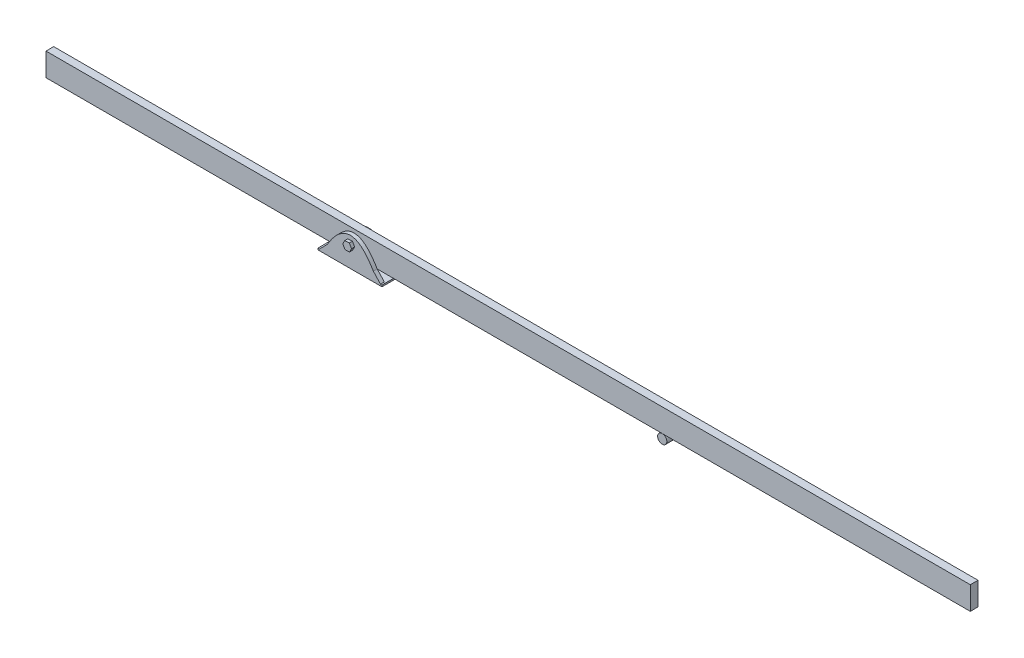
from build123d import *

# Parameters (mm, degrees)
SKETCH1_R                = 25
BOSS_EXTRUDE1_DEPTH      = 50
SKETCH1_R_2              = 30
BOSS_EXTRUDE1_2_DEPTH    = 50
SKETCH2_R                = 25
BOSS_EXTRUDE2_DEPTH      = 25
BOSS_EXTRUDE3_DEPTH      = 75
BOSS_EXTRUDE3_DEPTH_BACK = 25
SKETCH3_W                = 415.890953437
SKETCH3_H                = 10
SKETCH6_R                = 25
BOSS_EXTRUDE4_DEPTH      = 25
BOSS_EXTRUDE5_DEPTH      = 20
BOSS_EXTRUDE6_START      = 120
SKETCH10_R               = 25
BOSS_EXTRUDE6_DEPTH      = 120
SKETCH11_R               = 25
BOSS_EXTRUDE8_DEPTH      = 20


with BuildPart() as part:
    # Sketch1 → Boss-Extrude1 (new body)
    with BuildSketch(Plane.XY):
        Polygon((-3000, 75), (-3000, -75), (-1000, -75), (1000, -75), (3000, -75), (3000, 75), align=None)
        with Locations((-1000.00019516, -0.007806401)):
            Circle(SKETCH1_R, mode=Mode.SUBTRACT)
    extrude(amount=BOSS_EXTRUDE1_DEPTH)

    # Sketch2 → Boss-Extrude2 (add)
    with BuildSketch(Plane.XY.offset(50)):
        with BuildLine():
            Line((-1150.00019516, -75), (-1210.00019516, -135))
            Line((-1210.00019516, -135), (-794.109241723, -135))
            Line((-794.109241723, -135), (-850.00019516, -75))
            add(Edge.make_bspline(
                [(-1150.00019516, -75), (-1000.00019516, 179.221874073), (-850.00019516, -75)],
                knots=[0, 0, 0, 1, 1, 1], degree=2))
        make_face()
        with Locations((-1000.00019516, -0.007806401)):
            Circle(SKETCH2_R, mode=Mode.SUBTRACT)
    extrude(amount=BOSS_EXTRUDE2_DEPTH)

    # Sketch3 → Boss-Extrude3 (add, two sides: drawn at the far end of the back side and taken through both)
    with BuildSketch(Plane(origin=(0, 0, 50), x_dir=(-1, 0, 0), z_dir=(0, 0, -1)).offset(-BOSS_EXTRUDE3_DEPTH_BACK)):
        with Locations((1002.054718441, -130)):
            Rectangle(SKETCH3_W, SKETCH3_H)
    extrude(amount=BOSS_EXTRUDE3_DEPTH + BOSS_EXTRUDE3_DEPTH_BACK)

    # Sketch6 → Boss-Extrude4 (add)
    with BuildSketch(Plane(origin=(0, 0, -25), x_dir=(-1, 0, 0), z_dir=(0, 0, -1))):
        with BuildLine():
            Line((803.42440063, -125), (1200.00019516, -125))
            Line((1200.00019516, -125), (1150.00019516, -75))
            add(Edge.make_bspline(
                [(850.00019516, -75), (1000.00019516, 177.73404233), (1150.00019516, -75)],
                knots=[0, 0, 0, 1, 1, 1], degree=2))
            Line((850.00019516, -75), (803.42440063, -125))
        make_face()
        with Locations((1000.00019516, -0.007806401)):
            Circle(SKETCH6_R, mode=Mode.SUBTRACT)
    extrude(amount=-BOSS_EXTRUDE4_DEPTH)

    # Sketch8 → Boss-Extrude5 (add)
    with BuildSketch(Plane.XY.offset(75)):
        Polygon((-986.569847376, 25.59540955), (-1015.4580567, 24.424823937), (-1028.888404484, -1.178392013), (-1013.430542944, -25.611022351), (-984.542333621, -24.440436739), (-971.111985836, 1.162779212), align=None)
    extrude(amount=BOSS_EXTRUDE5_DEPTH)

    # Sketch10 → Boss-Extrude6 (add)
    with BuildSketch(Plane(origin=(0, 0, 75), x_dir=(-1, 0, 0), z_dir=(0, 0, -1)).offset(BOSS_EXTRUDE6_START)):
        with Locations((1000.00019516, -0.007806401)):
            Circle(SKETCH10_R)
    extrude(amount=-BOSS_EXTRUDE6_DEPTH)


with BuildPart() as body_2:
    # Sketch1 → Boss-Extrude1 2 (new body)
    with BuildSketch(Plane.XY):
        with Locations((1000, -105)):
            Circle(SKETCH1_R_2)
    extrude(amount=BOSS_EXTRUDE1_2_DEPTH)


with BuildPart() as body_3:
    # Sketch11 → Boss-Extrude8 (new body)
    with BuildSketch(Plane(origin=(0, 0, -25), x_dir=(-1, 0, 0), z_dir=(0, 0, -1))):
        Polygon((1018.881925628, 32.696310105), (981.118464692, 32.696310105), (962.236734224, -0.007806401), (981.118464692, -32.711922906), (1018.881925628, -32.711922906), (1037.763656096, -0.007806401), align=None)
        with Locations((1000.00019516, -0.007806401)):
            Circle(SKETCH11_R, mode=Mode.SUBTRACT)
    extrude(amount=BOSS_EXTRUDE8_DEPTH)


solid = Compound([part.part, body_2.part, body_3.part])
